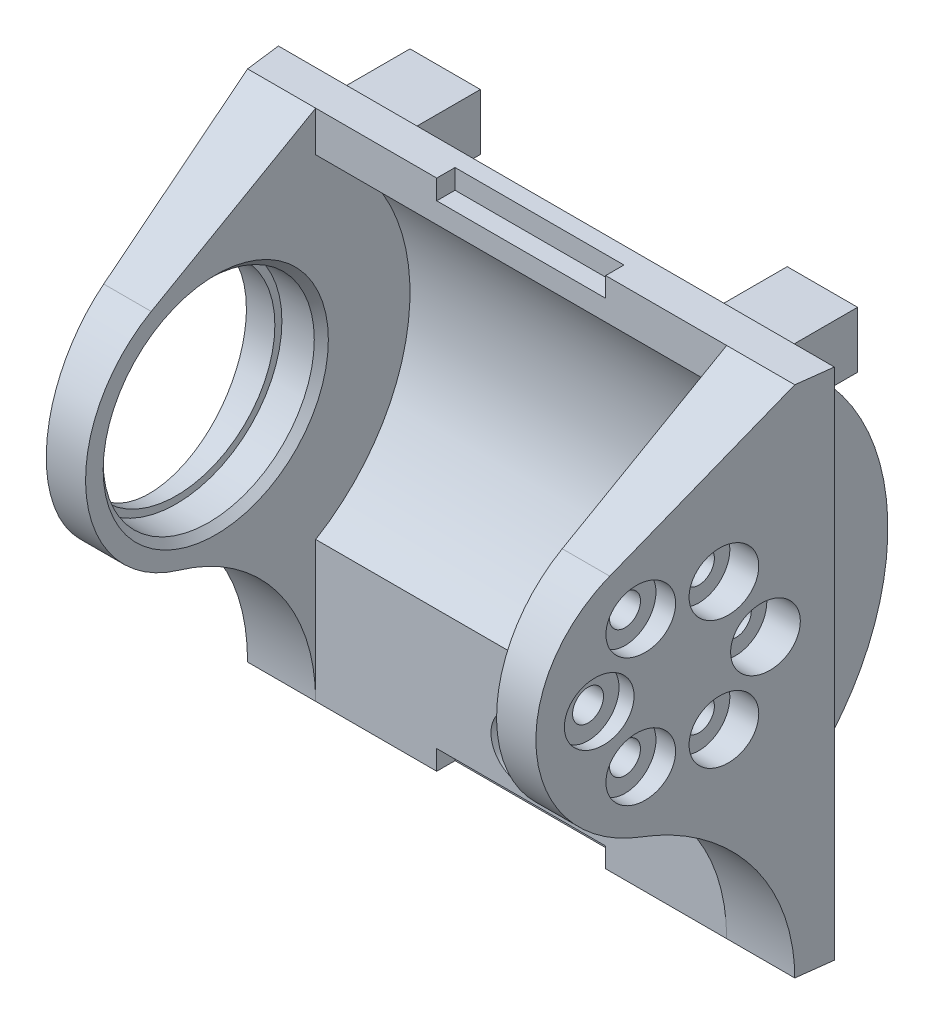
from build123d import *

# Parameters (mm, degrees)
SKETCH_1_W                   = 39.5
SKETCH_1_H                   = 36.5
EXTRUDE_1_DEPTH              = 2.5
EXTRUDE_START                = -2.6
EXTRUDE_2_DEPTH              = 34
EXTRUDE_START_2              = 14.6
EXTRUDE_3_DEPTH              = 5.15
SKETCH_4_W                   = 5
SKETCH_4_H                   = 4
EXTRUDE_4_DEPTH              = 5.5
CUT_EXTRUDE_1_REACH          = 50.117
CUT_EXTRUDE_1_END_RADIUS     = 16.3
SKETCH_5_W                   = 2
SKETCH_5_H                   = 1
CUT_EXTRUDE_2_DEPTH          = 29.2
SKETCH_7_R                   = 7.5
CUT_EXTRUDE_3_DEPTH          = 2.8
SKETCH_8_R                   = 7
CUT_EXTRUDE_4_DEPTH          = 56.3867764
CHAMFER_1_SIZE               = 0.5
SKETCH_9_W                   = 12
SKETCH_9_H                   = 1.4
CUT_EXTRUDE_5_DEPTH          = 1.3
HOLE_WIZARD_M2_1_D           = 2.2
HOLE_WIZARD_M2_1_CBORE_D     = 4.3
HOLE_WIZARD_M2_1_CBORE_DEPTH = 1
SKETCH_10_W                  = 12
SKETCH_10_H                  = 1.4
CUT_EXTRUDE_6_DEPTH          = 1.3
PATTERN_CIRCULAR_1_COUNT     = 6
CUT_EXTRUDE_7_DEPTH          = 46.581081602
SKETCH_17_R                  = 13.8
CUT_EXTRUDE_8_DEPTH          = 29.2


with BuildPart() as part:
    # 草图1 → 凸台-拉伸1 (new body)
    with BuildSketch(Plane.XY):
        with Locations((0, 18.25)):
            Rectangle(SKETCH_1_W, SKETCH_1_H)
    extrude(amount=EXTRUDE_1_DEPTH)

    # 草图2 → 凸台-拉伸2 (add)
    with BuildSketch(Plane.ZY.offset(19.75).offset(EXTRUDE_START)):
        with BuildLine():
            Line((2.5, 7.127576887), (2.5, 36.472423113))
            ThreePointArc((2.5, 36.472423113), (1.216414342, 35.778751429), (0, 34.973078608))
            Line((0, 34.973078608), (0, 8.626921392))
            ThreePointArc((0, 8.626921392), (1.216414342, 7.821248571), (2.5, 7.127576887))
        make_face()
        with BuildLine():
            Line((0, 8.626921392), (0, 34.973078608))
            ThreePointArc((0, 34.973078608), (-6.7, 21.8), (0, 8.626921392))
        make_face()
    extrude(amount=-EXTRUDE_2_DEPTH)

    # 草图3 → 凸台-拉伸3 (add, through all)
    with BuildSketch(Plane(origin=(0, 0, 0), x_dir=(0, 0, -1), z_dir=(1, 0, 0)).offset(EXTRUDE_START_2)):
        with BuildLine():
            Line((-2.5, 36.5), (-14.183665706, 29.834457586))
            ThreePointArc((-14.183665706, 29.834457586), (-18.787148585, 20.723523862), (-12.202183107, 12.923562478))
            ThreePointArc((-12.202183107, 12.923562478), (-5.203778934, 8.073846044), (-2.5, 0))
            Line((-2.5, 0), (-2.5, 36.5))
        make_face()
    extrude_3 = extrude(amount=EXTRUDE_3_DEPTH)

    # 镜向1: 凸台-拉伸3 across plane
    add(extrude_3.mirror(Plane(origin=(0, 0, 0), x_dir=(0, 0, 1), z_dir=(1, 0, 0))))

    # 草图4 → 凸台-拉伸4 (add)
    with BuildSketch(Plane(origin=(0, 0, 0), x_dir=(-1, 0, 0), z_dir=(0, 0, -1))):
        with Locations((-13.4, 33.5)):
            Rectangle(SKETCH_4_W, SKETCH_4_H)
        with Locations((13.4, 33.5)):
            Rectangle(SKETCH_4_W, SKETCH_4_H)
    extrude(amount=EXTRUDE_4_DEPTH)

    # 切除-拉伸1: up to this cylinder (the profile starts outside it)
    cut_extrude_1_end = Plane(origin=(0, 21.8, 9.6), z_dir=(-1, 0, 0)) * Cylinder(CUT_EXTRUDE_1_END_RADIUS, 160.634, mode=Mode.PRIVATE)
    # 草图5 → 切除-拉伸1 (cut, up to the surface)
    with BuildSketch(Plane(origin=(0, 0, -5.5), x_dir=(-1, 0, 0), z_dir=(0, 0, -1)), mode=Mode.PRIVATE) as cut_extrude_1_sk1:
        with Locations((-13.4, 33.5)):
            Rectangle(SKETCH_5_W, SKETCH_5_H)
    cut_extrude_1_tool1 = extrude(cut_extrude_1_sk1.sketch, amount=-CUT_EXTRUDE_1_REACH, mode=Mode.PRIVATE) - cut_extrude_1_end
    add(cut_extrude_1_tool1.solids().sort_by_distance((13.4, 33.5, -5.5))[0], mode=Mode.SUBTRACT)
    # 草图5 → 切除-拉伸1 (cut, up to the surface)
    with BuildSketch(Plane(origin=(0, 0, -5.5), x_dir=(-1, 0, 0), z_dir=(0, 0, -1)), mode=Mode.PRIVATE) as cut_extrude_1_sk2:
        with Locations((13.4, 33.5)):
            Rectangle(SKETCH_5_W, SKETCH_5_H)
    cut_extrude_1_tool2 = extrude(cut_extrude_1_sk2.sketch, amount=-CUT_EXTRUDE_1_REACH, mode=Mode.PRIVATE) - cut_extrude_1_end
    add(cut_extrude_1_tool2.solids().sort_by_distance((-13.4, 33.5, -5.5))[0], mode=Mode.SUBTRACT)

    # 草图6 → 切除-拉伸2 (cut)
    with BuildSketch(Plane(origin=(-14.6, 0, 0), x_dir=(0, 0, -1), z_dir=(1, 0, 0))):
        with BuildLine():
            Line((0, 31.713626985), (0, 11.886373015))
            ThreePointArc((0, 11.886373015), (-23.4, 21.8), (0, 31.713626985))
        make_face()
    extrude(amount=CUT_EXTRUDE_2_DEPTH, mode=Mode.SUBTRACT)

    # 草图7 → 切除-拉伸3 (cut)
    with BuildSketch(Plane(origin=(-14.6, 0, 0), x_dir=(0, 0, -1), z_dir=(1, 0, 0))):
        with Locations((-9.6, 21.8)):
            Circle(SKETCH_7_R)
    extrude(amount=-CUT_EXTRUDE_3_DEPTH, mode=Mode.SUBTRACT)

    # 草图8 → 切除-拉伸4 (cut, through all)
    with BuildSketch(Plane(origin=(-17.4, 0, 0), x_dir=(0, 0, -1), z_dir=(1, 0, 0))):
        with Locations((-9.6, 21.8)):
            Circle(SKETCH_8_R)
    extrude(amount=-CUT_EXTRUDE_4_DEPTH, mode=Mode.SUBTRACT)

    # 倒角1
    chamfer_1_edges = [part.edges().sort_by_distance(p)[0] for p in [
        (-14.6, 21.8, 17.1),
    ]]
    chamfer(chamfer_1_edges, length=CHAMFER_1_SIZE)

    # 草图9 → 切除-拉伸5 (cut)
    with BuildSketch(Plane.XY.offset(2.5)):
        with Locations((0, 35.8)):
            Rectangle(SKETCH_9_W, SKETCH_9_H)
    extrude(amount=-CUT_EXTRUDE_5_DEPTH, mode=Mode.SUBTRACT)

    # M2 六角圆柱头螺钉的柱形沉头孔1 (through all)
    with Locations(Plane.XY.offset(2.5)):
        with Locations((0, 4.3)):
            CounterBoreHole(HOLE_WIZARD_M2_1_D / 2, HOLE_WIZARD_M2_1_CBORE_D / 2, HOLE_WIZARD_M2_1_CBORE_DEPTH)

    # 草图10 → 切除-拉伸6 (cut)
    with BuildSketch(Plane.XY.offset(2.5)):
        with Locations((0, 0.7)):
            Rectangle(SKETCH_10_W, SKETCH_10_H)
    extrude(amount=-CUT_EXTRUDE_6_DEPTH, mode=Mode.SUBTRACT)

    # 草图15 → M2 六角圆柱头螺钉的柱形沉头孔2 (revolve, cut)
    with BuildSketch(Plane(origin=(19.75, 21.8, 14.85), x_dir=(0, 0, -1), z_dir=(0, 1, 0))):
        Polygon((0, 0), (0, 7.860946681), (1.1, 7.2), (1.1, 2.65), (2.2, 2.65), (2.2, 0), align=None)
    hole_wizard_m2_2 = revolve(axis=Axis((26.1, 21.8, 14.85), (-1, 0, 0)), mode=Mode.SUBTRACT)

    # 阵列(圆周)1: M2 六角圆柱头螺钉的柱形沉头孔2 ×6 about axis
    pattern_circular_1_axis = Axis((0, 21.8, 9.6), (1, 0, 0))
    for i in range(1, PATTERN_CIRCULAR_1_COUNT):
        add(hole_wizard_m2_2.rotate(pattern_circular_1_axis, i * 360 / PATTERN_CIRCULAR_1_COUNT), mode=Mode.SUBTRACT)

    # 草图16 → 切除-拉伸7 (cut, through all)
    with BuildSketch(Plane(origin=(0, 36.5, 0), x_dir=(1, 0, 0), z_dir=(0, 1, 0))):
        Polygon((19.75, 0), (17.392084769, -18.85), (19.75, -18.85), align=None)
        Polygon((-17.392084769, -18.85), (-19.75, -18.85), (-19.75, 0), align=None)
    extrude(amount=-CUT_EXTRUDE_7_DEPTH, mode=Mode.SUBTRACT)

    # 草图17 → 切除-拉伸8 (cut)
    with BuildSketch(Plane(origin=(-14.6, 0, 0), x_dir=(0, 0, -1), z_dir=(1, 0, 0))):
        with Locations((-9.6, 21.8)):
            Circle(SKETCH_17_R)
    extrude(amount=CUT_EXTRUDE_8_DEPTH, mode=Mode.SUBTRACT)


solid = part.part
